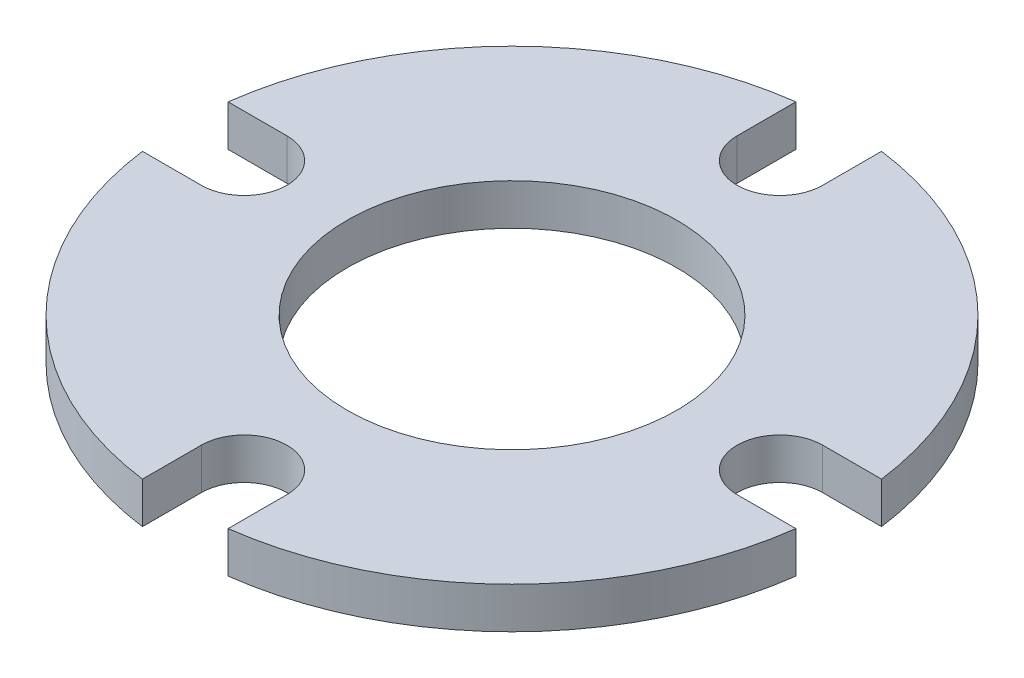
from build123d import *

# Parameters (mm, degrees)
BOSS_EXTRUDE1_DEPTH = 3.175
SKETCH3_R           = 12.7
CUT_EXTRUDE1_DEPTH  = 3.175


with BuildPart() as part:
    # Sketch2 → Boss-Extrude1 (new body)
    with BuildSketch(Plane(origin=(0, 0, 0), x_dir=(1, 0, 0), z_dir=(0, 1, 0))):
        with BuildLine():
            Line((20.6502, -3.302), (25.184455444, -3.302))
            ThreePointArc((25.184455444, -3.302), (17.960512242, -17.960512242), (3.302, -25.184455444))
            Line((3.302, -25.184455444), (3.302, -20.6502))
            ThreePointArc((3.302, -20.6502), (0, -17.3482), (-3.302, -20.6502))
            Line((-3.302, -20.6502), (-3.302, -25.184455444))
            ThreePointArc((-3.302, -25.184455444), (-17.960512242, -17.960512242), (-25.184455444, -3.302))
            Line((-25.184455444, -3.302), (-20.6502, -3.302))
            ThreePointArc((-20.6502, -3.302), (-17.3482, 0), (-20.6502, 3.302))
            Line((-20.6502, 3.302), (-25.184455444, 3.302))
            ThreePointArc((-25.184455444, 3.302), (-17.960512242, 17.960512242), (-3.302, 25.184455444))
            Line((-3.302, 25.184455444), (-3.302, 20.6502))
            ThreePointArc((-3.302, 20.6502), (0, 17.3482), (3.302, 20.6502))
            Line((3.302, 20.6502), (3.302, 25.184455444))
            ThreePointArc((3.302, 25.184455444), (17.960512242, 17.960512242), (25.184455444, 3.302))
            Line((25.184455444, 3.302), (20.6502, 3.302))
            ThreePointArc((20.6502, 3.302), (17.3482, 0), (20.6502, -3.302))
        make_face()
    extrude(amount=BOSS_EXTRUDE1_DEPTH)

    # Sketch3 → Cut-Extrude1 (cut)
    with BuildSketch(Plane(origin=(0, 3.175, 0), x_dir=(1, 0, 0), z_dir=(0, 1, 0))):
        with Locations(Location((0, 0, 0), (0, 0, 270))):
            Circle(SKETCH3_R)
    extrude(amount=-CUT_EXTRUDE1_DEPTH, mode=Mode.SUBTRACT)


solid = part.part
